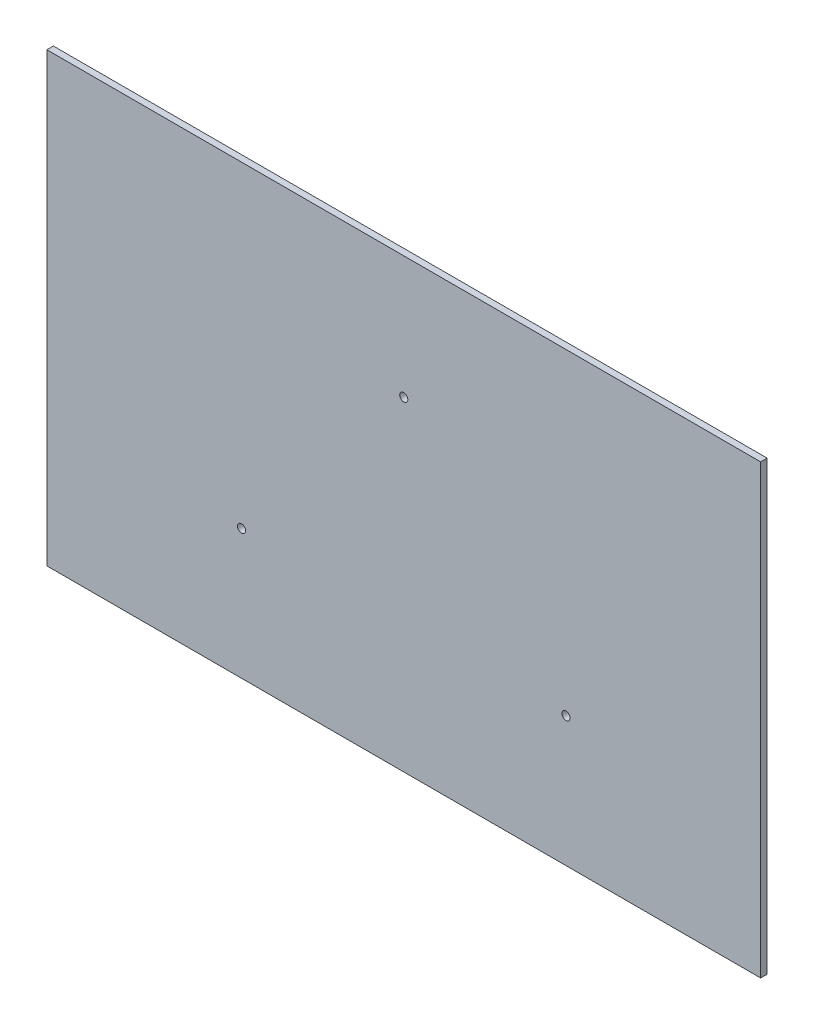
from build123d import *

# Parameters (mm, degrees)
SKETCH2_W           = 279.4
SKETCH2_H           = 174.977777778
SKETCH2_R           = 1.5875
BOSS_EXTRUDE1_DEPTH = 2.54


with BuildPart() as part:
    # Sketch2 → Boss-Extrude1 (new body)
    with BuildSketch(Plane.XY):
        Rectangle(SKETCH2_W, SKETCH2_H)
        with Locations((-63.5, -36.688888889)):
            Circle(SKETCH2_R, mode=Mode.SUBTRACT)
        with Locations((63.5, -36.688888889)):
            Circle(SKETCH2_R, mode=Mode.SUBTRACT)
        with Locations((0, 39.511111111)):
            Circle(SKETCH2_R, mode=Mode.SUBTRACT)
    extrude(amount=BOSS_EXTRUDE1_DEPTH)


solid = part.part
